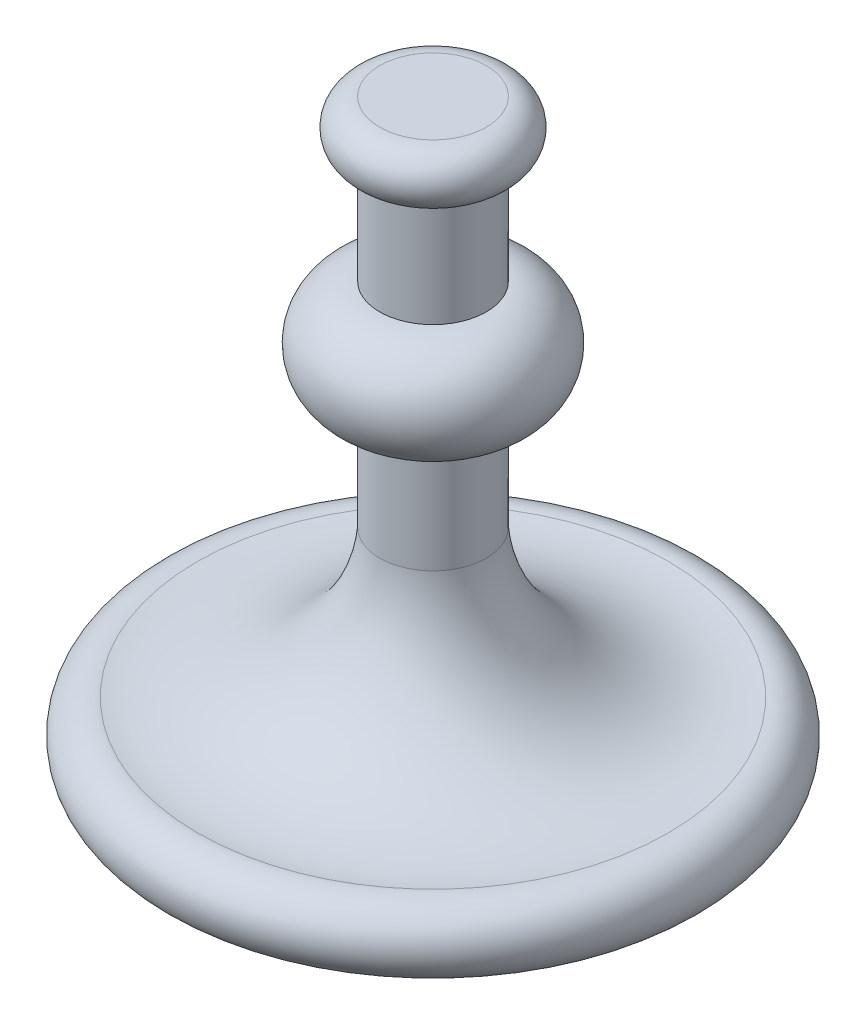
from build123d import *


with BuildPart() as part:
    # Szkic1 → Obrót1 (revolve)
    with BuildSketch(Plane.XY, mode=Mode.PRIVATE) as obr_t1_sk:
        with BuildLine():
            Line((0, 0), (0, 220))
            Line((0, 220), (20, 220))
            ThreePointArc((20, 220), (30, 210), (20, 200))
            Line((20, 200), (20, 160))
            ThreePointArc((20, 160), (40, 140), (20, 120))
            Line((20, 120), (20, 80))
            ThreePointArc((20, 80), (42.147094318, 37.608598857), (88.249440789, 24.876814713))
            ThreePointArc((88.249440789, 24.876814713), (102.469165648, 13.377444039), (90, 0))
            Line((90, 0), (0, 0))
        make_face()
    revolve(obr_t1_sk.sketch.rotate(Axis((0, 0, 0), (0, 1, 0)), 90), axis=Axis((0, 0, 0), (0, 1, 0)))


solid = part.part
